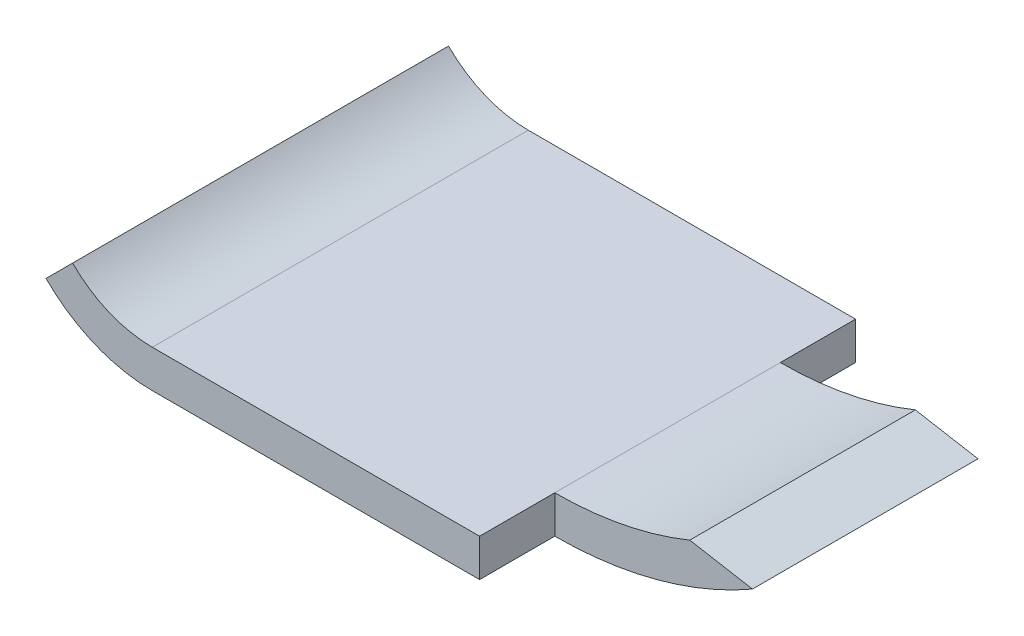
from build123d import *

# Parameters (mm, degrees)
BOSS_EXTRUDE1_DEPTH = 9.525
BOSS_EXTRUDE2_DEPTH = 3.175
BOSS_EXTRUDE3_START = -12.7
BOSS_EXTRUDE3_DEPTH = 3.175


with BuildPart() as part:
    # Sketch1 → Boss-Extrude1 (new body)
    with BuildSketch(Plane.XY):
        with BuildLine():
            Line((-6.9088, 0), (6.9088, 0))
            ThreePointArc((6.9088, 0), (11.229329629, 0.569673931), (15.254541002, 2.239757184))
            Line((15.254541002, 2.239757184), (12.609003955, 2.706236743))
            ThreePointArc((12.609003955, 2.706236743), (9.813274868, 1.869826819), (6.9088, 1.5875))
            Line((6.9088, 1.5875), (-6.9088, 1.5875))
            ThreePointArc((-6.9088, 1.5875), (-8.731329847, 1.950023726), (-10.276396045, 2.982403955))
            Line((-10.276396045, 2.982403955), (-11.398928061, 1.859871939))
            ThreePointArc((-11.398928061, 1.859871939), (-9.338839796, 0.483364969), (-6.9088, 0))
        make_face()
    extrude(amount=BOSS_EXTRUDE1_DEPTH)

    # Sketch2 → Boss-Extrude2 (add)
    with BuildSketch(Plane.XY.offset(9.525)):
        with BuildLine():
            Line((6.9088, 0), (6.9088, 1.5875))
            Line((6.9088, 1.5875), (-6.9088, 1.5875))
            ThreePointArc((-6.9088, 1.5875), (-8.731329847, 1.950023726), (-10.276396045, 2.982403955))
            Line((-10.276396045, 2.982403955), (-11.398928061, 1.859871939))
            ThreePointArc((-11.398928061, 1.859871939), (-9.338839796, 0.483364969), (-6.9088, 0))
            Line((-6.9088, 0), (6.9088, 0))
        make_face()
    extrude(amount=BOSS_EXTRUDE2_DEPTH)

    # Sketch2<2> → Boss-Extrude3 (add)
    with BuildSketch(Plane.XY.offset(9.525).offset(BOSS_EXTRUDE3_START)):
        with BuildLine():
            Line((-6.9088, 0), (6.9088, 0))
            Line((6.9088, 0), (6.9088, 1.5875))
            Line((6.9088, 1.5875), (-6.9088, 1.5875))
            ThreePointArc((-6.9088, 1.5875), (-8.731329847, 1.950023726), (-10.276396045, 2.982403955))
            Line((-10.276396045, 2.982403955), (-11.398928061, 1.859871939))
            ThreePointArc((-11.398928061, 1.859871939), (-9.338839796, 0.483364969), (-6.9088, 0))
        make_face()
    extrude(amount=BOSS_EXTRUDE3_DEPTH)


solid = part.part
